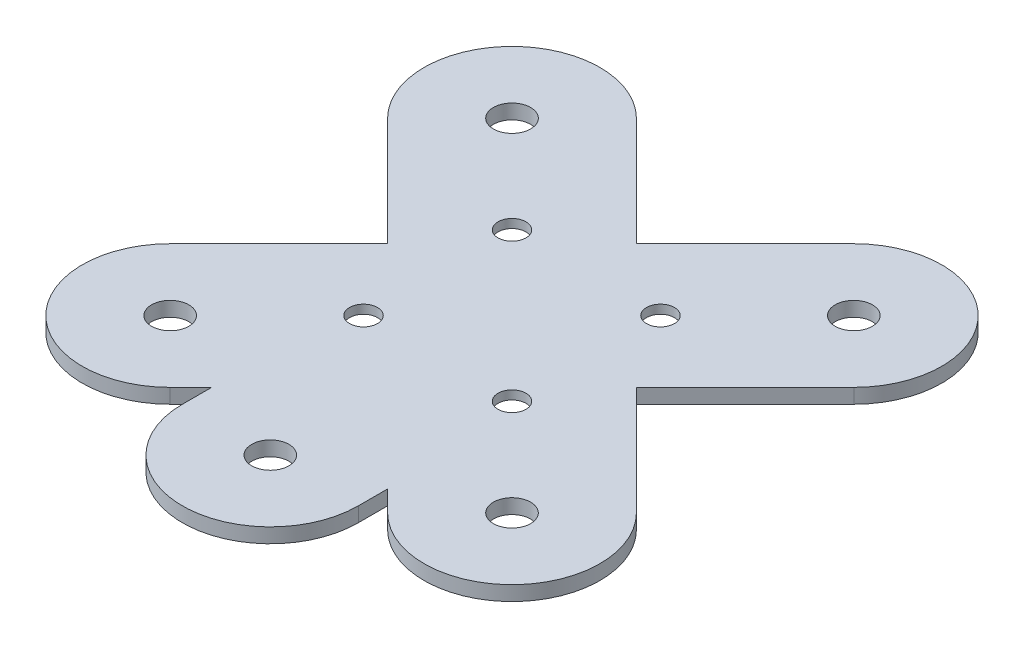
from build123d import *

# Parameters (mm, degrees)
BOSS_EXTRU_1_DEPTH      = 5
ENL_V_MAT_EXTRU_1_DEPTH = 2
ESQUISSE5_R             = 4.7625
ENL_V_MAT_EXTRU_2_DEPTH = 143.978353297
ESQUISSE7_R             = 6.35
ENL_V_MAT_EXTRU_3_DEPTH = 144.034294879


with BuildPart() as part:
    # Esquisse2 → Boss.-Extru.1 (new body)
    with BuildSketch(Plane(origin=(0, 0, 0), x_dir=(1, 0, 0), z_dir=(0, 1, 0))):
        with BuildLine():
            Line((79.497474683, -37.071067812), (42.426406871, 0))
            Line((42.426406871, 0), (79.497474683, 37.071067812))
            ThreePointArc((79.497474683, 37.071067812), (79.497474683, 79.497474683), (37.071067812, 79.497474683))
            Line((37.071067812, 79.497474683), (0, 42.426406871))
            Line((0, 42.426406871), (-37.071067812, 79.497474683))
            ThreePointArc((-37.071067812, 79.497474683), (-79.497474683, 79.497474683), (-79.497474683, 37.071067812))
            Line((-79.497474683, 37.071067812), (-42.426406871, 0))
            Line((-42.426406871, 0), (-79.497474683, -37.071067812))
            ThreePointArc((-79.497474683, -37.071067812), (-79.497474683, -79.497474683), (-37.071067812, -79.497474683))
            Line((-37.071067812, -79.497474683), (-30, -72.426406871))
            Line((-30, -72.426406871), (-30, -82.426406871))
            ThreePointArc((-30, -82.426406871), (0, -112.426406871), (30, -82.426406871))
            Line((30, -82.426406871), (30, -72.426406871))
            Line((30, -72.426406871), (37.071067812, -79.497474683))
            ThreePointArc((37.071067812, -79.497474683), (79.497474683, -79.497474683), (79.497474683, -37.071067812))
        make_face()
    extrude(amount=BOSS_EXTRU_1_DEPTH)

    # Esquisse4 → Enlèv. mat.-Extru.1 (cut)
    with BuildSketch(Plane(origin=(0, 0, 0), x_dir=(-1, 0, 0), z_dir=(0, -1, 0))):
        with BuildLine():
            Line((-33.535533906, -33.535533906), (-18.245921943, -18.245921943))
            Line((-18.245921943, -18.245921943), (-28.852523661, -7.639320225))
            Line((-28.852523661, -7.639320225), (-46.53019319, -25.316989755))
            ThreePointArc((-46.53019319, -25.316989755), (-39.575984314, -28.703872332), (-33.535533906, -33.535533906))
        make_face()
        with BuildLine():
            Line((-7.639320225, -28.852523661), (-18.245921943, -18.245921943))
            Line((-18.245921943, -18.245921943), (-33.535533906, -33.535533906))
            ThreePointArc((-33.535533906, -33.535533906), (-28.703872332, -39.575984314), (-25.316989755, -46.53019319))
            Line((-25.316989755, -46.53019319), (-7.639320225, -28.852523661))
        make_face()
        with BuildLine():
            ThreePointArc((-46.53019319, 25.316989755), (-33.535533906, 33.535533906), (-25.316989755, 46.53019319))
            Line((-25.316989755, 46.53019319), (-7.639320225, 28.852523661))
            Line((-7.639320225, 28.852523661), (-28.852523661, 7.639320225))
            Line((-28.852523661, 7.639320225), (-46.53019319, 25.316989755))
        make_face()
        with BuildLine():
            ThreePointArc((25.316989755, 46.53019319), (33.535533906, 33.535533906), (46.53019319, 25.316989755))
            Line((46.53019319, 25.316989755), (28.852523661, 7.639320225))
            Line((28.852523661, 7.639320225), (7.639320225, 28.852523661))
            Line((7.639320225, 28.852523661), (25.316989755, 46.53019319))
        make_face()
        with BuildLine():
            ThreePointArc((46.53019319, -25.316989755), (33.535533906, -33.535533906), (25.316989755, -46.53019319))
            Line((25.316989755, -46.53019319), (7.639320225, -28.852523661))
            Line((7.639320225, -28.852523661), (28.852523661, -7.639320225))
            Line((28.852523661, -7.639320225), (46.53019319, -25.316989755))
        make_face()
    extrude(amount=-ENL_V_MAT_EXTRU_1_DEPTH, mode=Mode.SUBTRACT)

    # Esquisse5 → Enlèv. mat.-Extru.2 (cut, through all)
    with BuildSketch(Plane(origin=(0, 2, 0), x_dir=(-1, 0, 0), z_dir=(0, -1, 0))):
        with Locations(Location((-25.316989755, -25.316989755, 0), (0, 0, 90))):
            Circle(ESQUISSE5_R)
        with Locations(Location((-25.316989755, 25.316989755, 0), (0, 0, 90))):
            Circle(ESQUISSE5_R)
        with Locations(Location((25.316989755, 25.316989755, 0), (0, 0, 90))):
            Circle(ESQUISSE5_R)
        with Locations(Location((25.316989755, -25.316989755, 0), (0, 0, 90))):
            Circle(ESQUISSE5_R)
    extrude(amount=-ENL_V_MAT_EXTRU_2_DEPTH, mode=Mode.SUBTRACT)

    # Esquisse7 → Enlèv. mat.-Extru.3 (cut, through all)
    with BuildSketch(Plane(origin=(0, 0, 0), x_dir=(-1, 0, 0), z_dir=(0, -1, 0))):
        with Locations(Location((0, -82.426406871, 0), (0, 0, 90))):
            Circle(ESQUISSE7_R)
        with Locations(Location((-58.284271247, -58.284271247, 0), (0, 0, 90))):
            Circle(ESQUISSE7_R)
        with Locations(Location((-58.284271247, 58.284271247, 0), (0, 0, 90))):
            Circle(ESQUISSE7_R)
        with Locations(Location((58.284271247, 58.284271247, 0), (0, 0, 90))):
            Circle(ESQUISSE7_R)
        with Locations(Location((58.284271247, -58.284271247, 0), (0, 0, 90))):
            Circle(ESQUISSE7_R)
    extrude(amount=-ENL_V_MAT_EXTRU_3_DEPTH, mode=Mode.SUBTRACT)


solid = part.part
